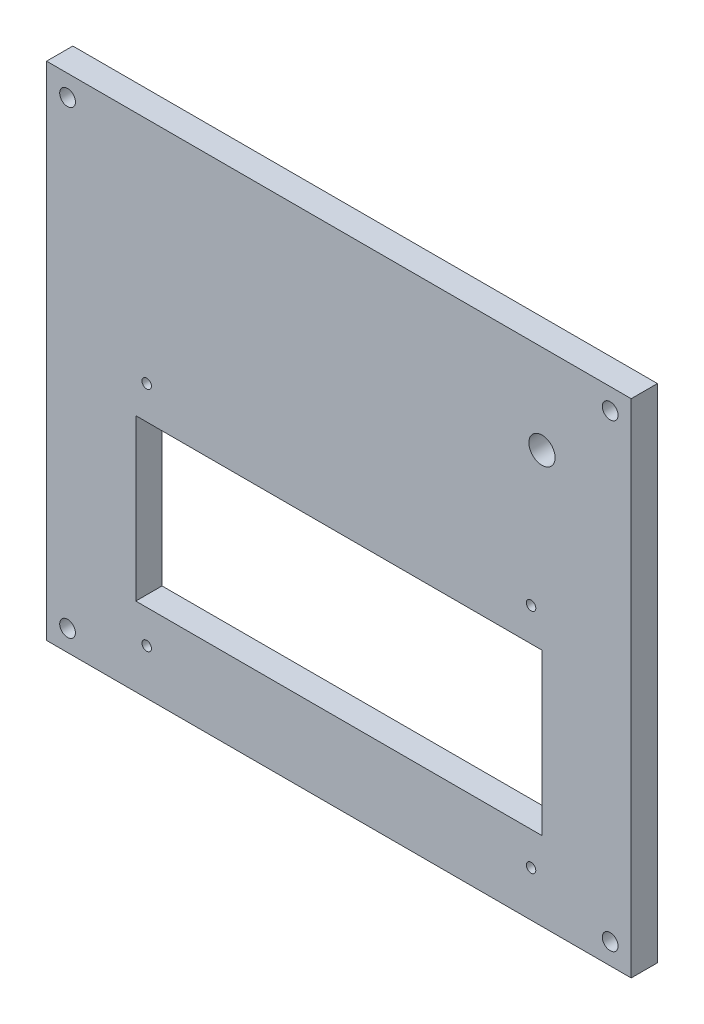
from build123d import *

# Parameters (mm, degrees)
SKETCH1_W           = 141.478
SKETCH1_H           = 121.412
SKETCH1_R           = 3.175
SKETCH1_W_2         = 98.298
SKETCH1_H_2         = 38.862
BOSS_EXTRUDE1_DEPTH = 6.35
SKETCH2_W           = 61.473578211
SKETCH2_H           = 35.56
CUT_EXTRUDE1_DEPTH  = 3.81
SKETCH3_R           = 1.143
CUT_EXTRUDE2_DEPTH  = 158.770193915
SKETCH4_R           = 1.905
CUT_EXTRUDE3_DEPTH  = 158.770193915


with BuildPart() as part:
    # Sketch1 → Boss-Extrude1 (new body)
    with BuildSketch(Plane.XY):
        with Locations((49.149, 41.656)):
            Rectangle(SKETCH1_W, SKETCH1_H)
        with Locations((98.298, 80.772)):
            Circle(SKETCH1_R, mode=Mode.SUBTRACT)
        with Locations((49.149, 19.431)):
            Rectangle(SKETCH1_W_2, SKETCH1_H_2, mode=Mode.SUBTRACT)
    extrude(amount=BOSS_EXTRUDE1_DEPTH)

    # Sketch2 → Cut-Extrude1 (cut)
    with BuildSketch(Plane(origin=(0, 0, 0), x_dir=(-1, 0, 0), z_dir=(0, 0, -1))):
        with Locations((-30.736789106, 56.642)):
            Rectangle(SKETCH2_W, SKETCH2_H)
    extrude(amount=-CUT_EXTRUDE1_DEPTH, mode=Mode.SUBTRACT)

    # Sketch3 → Cut-Extrude2 (cut, through all)
    with BuildSketch(Plane.XY.offset(6.35)):
        with Locations((2.6416, 46.9138)):
            Circle(SKETCH3_R)
        with Locations((95.6564, 46.9138)):
            Circle(SKETCH3_R)
        with Locations((95.6564, -8.0518)):
            Circle(SKETCH3_R)
        with Locations((2.6416, -8.0518)):
            Circle(SKETCH3_R)
    extrude(amount=-CUT_EXTRUDE2_DEPTH, mode=Mode.SUBTRACT)

    # Sketch4 → Cut-Extrude3 (cut, through all)
    with BuildSketch(Plane.XY.offset(6.35)):
        with Locations((-16.51, 97.282)):
            Circle(SKETCH4_R)
        with Locations((-16.51, -13.97)):
            Circle(SKETCH4_R)
        with Locations((114.808, -13.97)):
            Circle(SKETCH4_R)
        with Locations((114.808, 97.282)):
            Circle(SKETCH4_R)
    extrude(amount=-CUT_EXTRUDE3_DEPTH, mode=Mode.SUBTRACT)


solid = part.part
